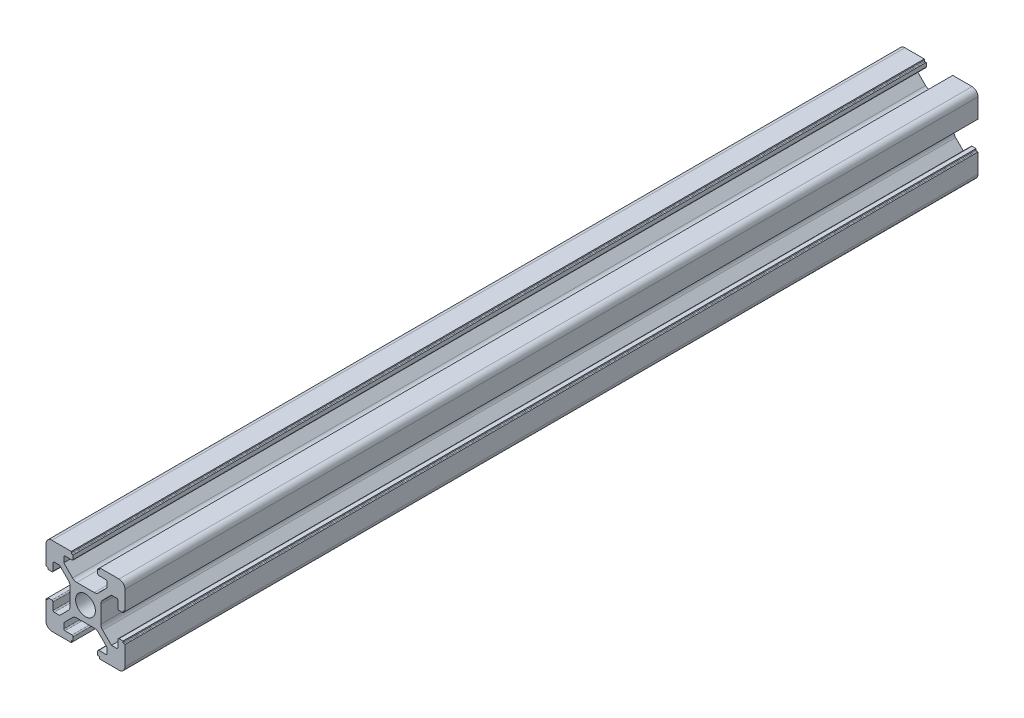
from build123d import *

# Parameters (mm, degrees)
SKETCH_1_R      = 2.5
EXTRUDE_1_DEPTH = 216


with BuildPart() as part:
    # 草图1 → 凸台-拉伸1 (new body)
    with BuildSketch(Plane.XY):
        with BuildLine():
            Line((4.215995631, 3.244230202), (6.436655803, 5.464890373))
            Line((6.436655803, 5.464890373), (7.776655803, 5.464890373))
            ThreePointArc((7.776655803, 5.464890373), (7.988787838, 5.377022408), (8.076655803, 5.164890373))
            Line((8.076655803, 5.164890373), (8.076655803, 3.364890373))
            ThreePointArc((8.076655803, 3.364890373), (8.164523769, 3.152758339), (8.376655803, 3.064890373))
            Line((8.376655803, 3.064890373), (9.376655803, 3.064890373))
            Line((9.376655803, 3.064890373), (9.376655803, 3.364890373))
            ThreePointArc((9.376655803, 3.364890373), (9.435234447, 3.50631173), (9.576655803, 3.564890373))
            Line((9.576655803, 3.564890373), (9.876655803, 3.564890373))
            Line((9.876655803, 3.564890373), (9.876655803, 8.464890373))
            ThreePointArc((9.876655803, 8.464890373), (9.437315975, 9.525550545), (8.376655803, 9.964890373))
            Line((8.376655803, 9.964890373), (3.476655803, 9.964890373))
            Line((3.476655803, 9.964890373), (3.476655803, 9.664890373))
            ThreePointArc((3.476655803, 9.664890373), (3.418077159, 9.523469017), (3.276655803, 9.464890373))
            Line((3.276655803, 9.464890373), (2.976655803, 9.464890373))
            Line((2.976655803, 9.464890373), (2.976655803, 8.464890373))
            ThreePointArc((2.976655803, 8.464890373), (3.064523769, 8.252758339), (3.276655803, 8.164890373))
            Line((3.276655803, 8.164890373), (5.076655803, 8.164890373))
            ThreePointArc((5.076655803, 8.164890373), (5.288787838, 8.077022408), (5.376655803, 7.864890373))
            Line((5.376655803, 7.864890373), (5.376655803, 6.524890373))
            Line((5.376655803, 6.524890373), (3.155995631, 4.304230202))
            ThreePointArc((3.155995631, 4.304230202), (2.669360608, 3.979071075), (2.09533546, 3.864890373))
            Line((2.09533546, 3.864890373), (-2.342023853, 3.864890373))
            ThreePointArc((-2.342023853, 3.864890373), (-2.916049002, 3.979071075), (-3.402684025, 4.304230202))
            Line((-3.402684025, 4.304230202), (-5.623344197, 6.524890373))
            Line((-5.623344197, 6.524890373), (-5.623344197, 7.864890373))
            ThreePointArc((-5.623344197, 7.864890373), (-5.535476231, 8.077022408), (-5.323344197, 8.164890373))
            Line((-5.323344197, 8.164890373), (-3.523344197, 8.164890373))
            ThreePointArc((-3.523344197, 8.164890373), (-3.311212162, 8.252758339), (-3.223344197, 8.464890373))
            Line((-3.223344197, 8.464890373), (-3.223344197, 9.464890373))
            Line((-3.223344197, 9.464890373), (-3.523344197, 9.464890373))
            ThreePointArc((-3.523344197, 9.464890373), (-3.664765553, 9.523469017), (-3.723344197, 9.664890373))
            Line((-3.723344197, 9.664890373), (-3.723344197, 9.964890373))
            Line((-3.723344197, 9.964890373), (-8.623344197, 9.964890373))
            ThreePointArc((-8.623344197, 9.964890373), (-9.684004369, 9.525550545), (-10.123344197, 8.464890373))
            Line((-10.123344197, 8.464890373), (-10.123344197, 3.564890373))
            Line((-10.123344197, 3.564890373), (-9.823344197, 3.564890373))
            ThreePointArc((-9.823344197, 3.564890373), (-9.681922841, 3.50631173), (-9.623344197, 3.364890373))
            Line((-9.623344197, 3.364890373), (-9.623344197, 3.064890373))
            Line((-9.623344197, 3.064890373), (-8.623344197, 3.064890373))
            ThreePointArc((-8.623344197, 3.064890373), (-8.411212162, 3.152758339), (-8.323344197, 3.364890373))
            Line((-8.323344197, 3.364890373), (-8.323344197, 5.164890373))
            ThreePointArc((-8.323344197, 5.164890373), (-8.235476231, 5.377022408), (-8.023344197, 5.464890373))
            Line((-8.023344197, 5.464890373), (-6.683344197, 5.464890373))
            Line((-6.683344197, 5.464890373), (-4.462684025, 3.244230202))
            ThreePointArc((-4.462684025, 3.244230202), (-4.137524898, 2.757595178), (-4.023344197, 2.18357003))
            Line((-4.023344197, 2.18357003), (-4.023344197, -2.253789283))
            ThreePointArc((-4.023344197, -2.253789283), (-4.137524898, -2.827814432), (-4.462684025, -3.314449455))
            Line((-4.462684025, -3.314449455), (-6.683344197, -5.535109627))
            Line((-6.683344197, -5.535109627), (-8.023344197, -5.535109627))
            ThreePointArc((-8.023344197, -5.535109627), (-8.235476231, -5.447241661), (-8.323344197, -5.235109627))
            Line((-8.323344197, -5.235109627), (-8.323344197, -3.435109627))
            ThreePointArc((-8.323344197, -3.435109627), (-8.411212162, -3.222977592), (-8.623344197, -3.135109627))
            Line((-8.623344197, -3.135109627), (-9.623344197, -3.135109627))
            Line((-9.623344197, -3.135109627), (-9.623344197, -3.435109627))
            ThreePointArc((-9.623344197, -3.435109627), (-9.681922841, -3.576530983), (-9.823344197, -3.635109627))
            Line((-9.823344197, -3.635109627), (-10.123344197, -3.635109627))
            Line((-10.123344197, -3.635109627), (-10.123344197, -8.535109627))
            ThreePointArc((-10.123344197, -8.535109627), (-9.684004369, -9.595769798), (-8.623344197, -10.035109627))
            Line((-8.623344197, -10.035109627), (-3.723344197, -10.035109627))
            Line((-3.723344197, -10.035109627), (-3.723344197, -9.735109627))
            ThreePointArc((-3.723344197, -9.735109627), (-3.664765553, -9.59368827), (-3.523344197, -9.535109627))
            Line((-3.523344197, -9.535109627), (-3.223344197, -9.535109627))
            Line((-3.223344197, -9.535109627), (-3.223344197, -8.535109627))
            ThreePointArc((-3.223344197, -8.535109627), (-3.311212162, -8.322977592), (-3.523344197, -8.235109627))
            Line((-3.523344197, -8.235109627), (-5.323344197, -8.235109627))
            ThreePointArc((-5.323344197, -8.235109627), (-5.535476231, -8.147241661), (-5.623344197, -7.935109627))
            Line((-5.623344197, -7.935109627), (-5.623344197, -6.595109627))
            Line((-5.623344197, -6.595109627), (-3.402684025, -4.374449455))
            ThreePointArc((-3.402684025, -4.374449455), (-2.916049002, -4.049290328), (-2.342023853, -3.935109627))
            Line((-2.342023853, -3.935109627), (2.09533546, -3.935109627))
            ThreePointArc((2.09533546, -3.935109627), (2.669360608, -4.049290328), (3.155995631, -4.374449455))
            Line((3.155995631, -4.374449455), (5.376655803, -6.595109627))
            Line((5.376655803, -6.595109627), (5.376655803, -7.935109627))
            ThreePointArc((5.376655803, -7.935109627), (5.288787838, -8.147241661), (5.076655803, -8.235109627))
            Line((5.076655803, -8.235109627), (3.276655803, -8.235109627))
            ThreePointArc((3.276655803, -8.235109627), (3.064523769, -8.322977592), (2.976655803, -8.535109627))
            Line((2.976655803, -8.535109627), (2.976655803, -9.535109627))
            Line((2.976655803, -9.535109627), (3.276655803, -9.535109627))
            ThreePointArc((3.276655803, -9.535109627), (3.418077159, -9.59368827), (3.476655803, -9.735109627))
            Line((3.476655803, -9.735109627), (3.476655803, -10.035109627))
            Line((3.476655803, -10.035109627), (8.376655803, -10.035109627))
            ThreePointArc((8.376655803, -10.035109627), (9.437315975, -9.595769798), (9.876655803, -8.535109627))
            Line((9.876655803, -8.535109627), (9.876655803, -3.635109627))
            Line((9.876655803, -3.635109627), (9.576655803, -3.635109627))
            ThreePointArc((9.576655803, -3.635109627), (9.435234447, -3.576530983), (9.376655803, -3.435109627))
            Line((9.376655803, -3.435109627), (9.376655803, -3.135109627))
            Line((9.376655803, -3.135109627), (8.376655803, -3.135109627))
            ThreePointArc((8.376655803, -3.135109627), (8.164523769, -3.222977592), (8.076655803, -3.435109627))
            Line((8.076655803, -3.435109627), (8.076655803, -5.235109627))
            ThreePointArc((8.076655803, -5.235109627), (7.988787838, -5.447241661), (7.776655803, -5.535109627))
            Line((7.776655803, -5.535109627), (6.436655803, -5.535109627))
            Line((6.436655803, -5.535109627), (4.215995631, -3.314449455))
            ThreePointArc((4.215995631, -3.314449455), (3.890836504, -2.827814432), (3.776655803, -2.253789283))
            Line((3.776655803, -2.253789283), (3.776655803, 2.18357003))
            ThreePointArc((3.776655803, 2.18357003), (3.890836504, 2.757595178), (4.215995631, 3.244230202))
        make_face()
        with Locations((-0.123344197, -0.035109627)):
            Circle(SKETCH_1_R, mode=Mode.SUBTRACT)
    extrude(amount=EXTRUDE_1_DEPTH)


solid = part.part
